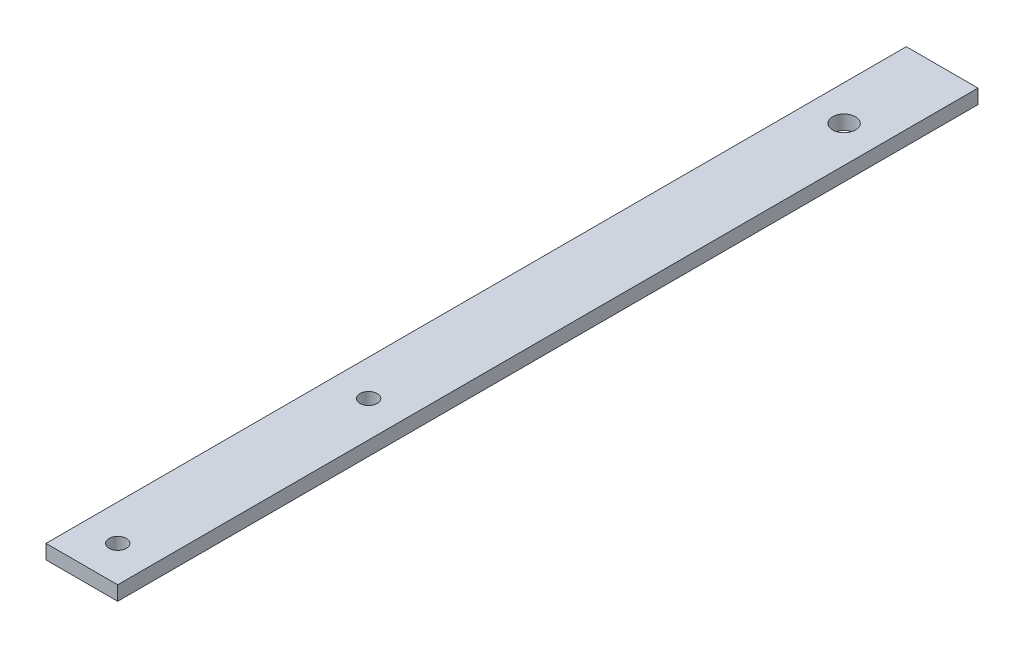
from build123d import *

# Parameters (mm, degrees)
SKETCH1_W           = 25
SKETCH1_H           = 300
SKETCH1_R           = 3
BOSS_EXTRUDE1_DEPTH = 5
SKETCH2_R           = 4
CUT_EXTRUDE1_DEPTH  = 302.081384346


with BuildPart() as part:
    # Sketch1 → Boss-Extrude1 (new body)
    with BuildSketch(Plane(origin=(0, 0, 0), x_dir=(1, 0, 0), z_dir=(0, 1, 0))):
        with Locations((12.5, 150)):
            Rectangle(SKETCH1_W, SKETCH1_H)
        with Locations(Location((12.5, 12.5, 0), (0, 0, 270))):
            Circle(SKETCH1_R, mode=Mode.SUBTRACT)
        with Locations(Location((12.5, 100, 0), (0, 0, 270))):
            Circle(SKETCH1_R, mode=Mode.SUBTRACT)
    extrude(amount=BOSS_EXTRUDE1_DEPTH)

    # Sketch2 → Cut-Extrude1 (cut, through all)
    with BuildSketch(Plane(origin=(0, 5, 0), x_dir=(1, 0, 0), z_dir=(0, 1, 0))):
        with Locations(Location((12.3, 266, 0), (0, 0, 270))):
            Circle(SKETCH2_R)
    extrude(amount=-CUT_EXTRUDE1_DEPTH, mode=Mode.SUBTRACT)


solid = part.part
